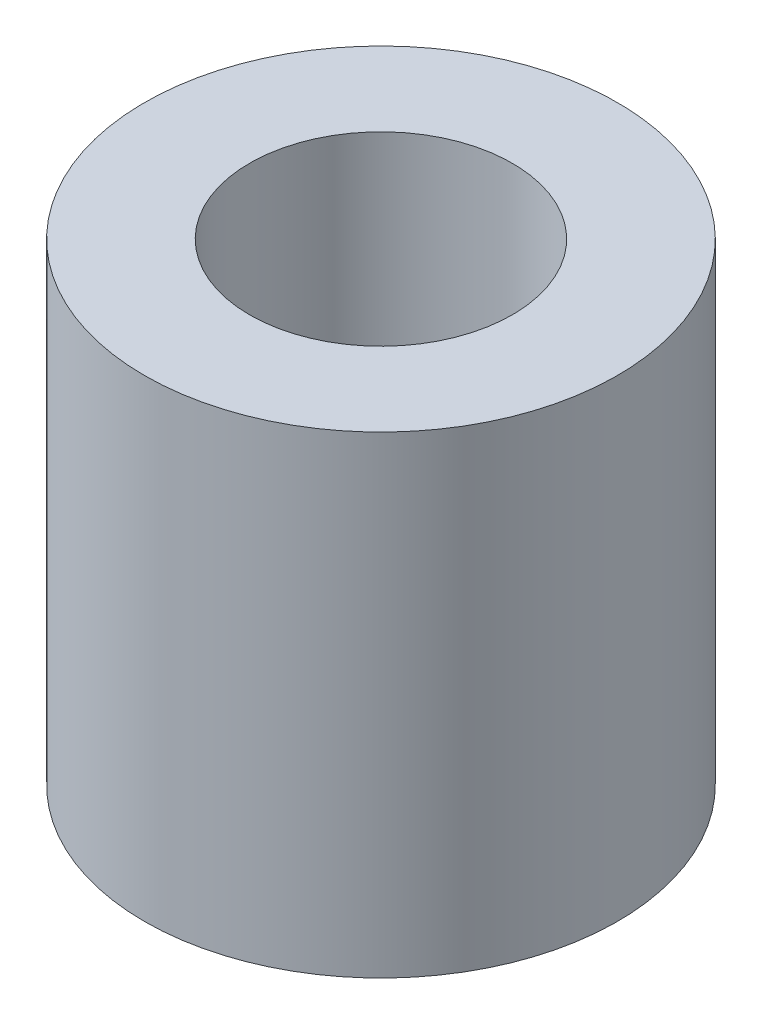
from build123d import *

# Parameters (mm, degrees)
SKETCH1_R           = 4.5
SKETCH1_R_2         = 2.5
BOSS_EXTRUDE1_DEPTH = 9


with BuildPart() as part:
    # Sketch1 → Boss-Extrude1 (new body)
    with BuildSketch(Plane(origin=(0, 0, 0), x_dir=(1, 0, 0), z_dir=(0, 1, 0))):
        with Locations(Location((0, 0, 0), (0, 0, 270))):
            Circle(SKETCH1_R)
        with Locations(Location((0, 0, 0), (0, 0, 270))):
            Circle(SKETCH1_R_2, mode=Mode.SUBTRACT)
    extrude(amount=BOSS_EXTRUDE1_DEPTH)


solid = part.part
